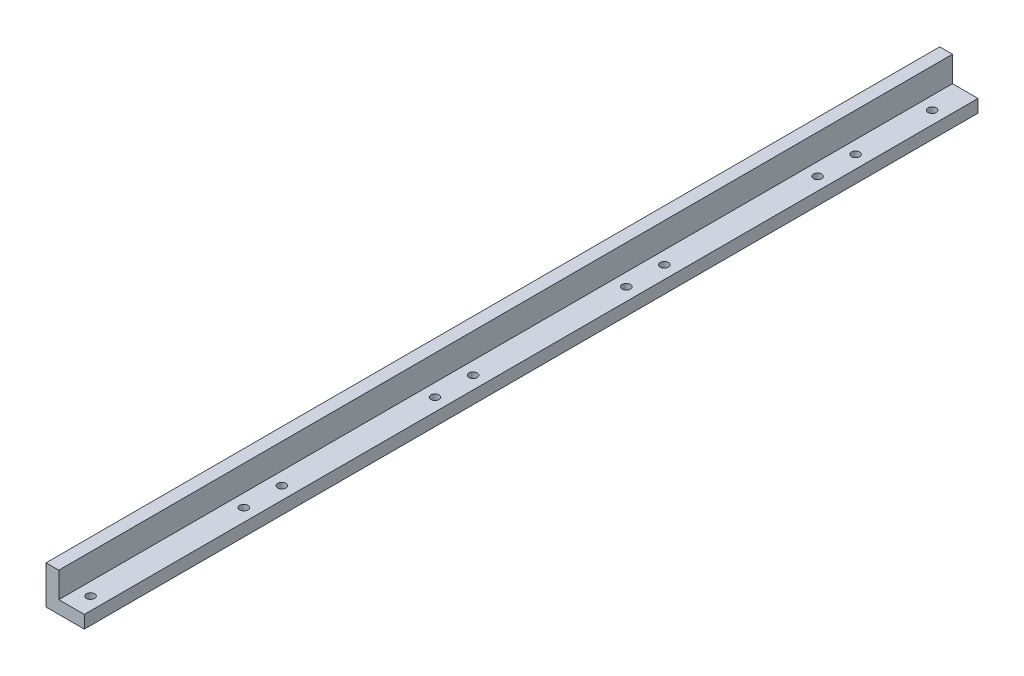
from build123d import *

# Parameters (mm, degrees)
BOSS_EXTRUDE1_DEPTH                  = 350
F_3_2_3_2_DIAMETER_HOLE1_D           = 3.2
LPATTERN2_COUNT                      = 4
LPATTERN2_PITCH                      = 74.9
F_3_2_3_2_DIAMETERHOLEFORAHALFPART_D = 3.2


with BuildPart() as part:
    # Sketch1 → Boss-Extrude1 (new body)
    with BuildSketch(Plane.XY):
        Polygon((0, 0), (0, 15), (5, 15), (5, 5), (15, 5), (15, 0), align=None)
    extrude(amount=BOSS_EXTRUDE1_DEPTH)

    # Ø3.2 (3.2) Diameter Hole1 (through all)
    with Locations(Plane(origin=(0, 0, 0), x_dir=(-1, 0, 0), z_dir=(0, -1, 0))):
        with Locations((-10, -342.55), (-10, -282.55)):
            f_3_2_3_2_diameter_hole1 = Hole(F_3_2_3_2_DIAMETER_HOLE1_D / 2)

    # LPattern2: Ø3.2 (3.2) Diameter Hole1 ×4
    with Locations(*[(0, 0, -i * LPATTERN2_PITCH) for i in range(1, LPATTERN2_COUNT)]):
        add(f_3_2_3_2_diameter_hole1, mode=Mode.SUBTRACT)

    # Ø3.2 (3.2) DiameterHoleForAHalfPart (through all)
    with Locations(Plane(origin=(0, 0, 0), x_dir=(-1, 0, 0), z_dir=(0, -1, 0))):
        with Locations((-10, -42.95), (-10, -12.95)):
            Hole(F_3_2_3_2_DIAMETERHOLEFORAHALFPART_D / 2)


solid = part.part
